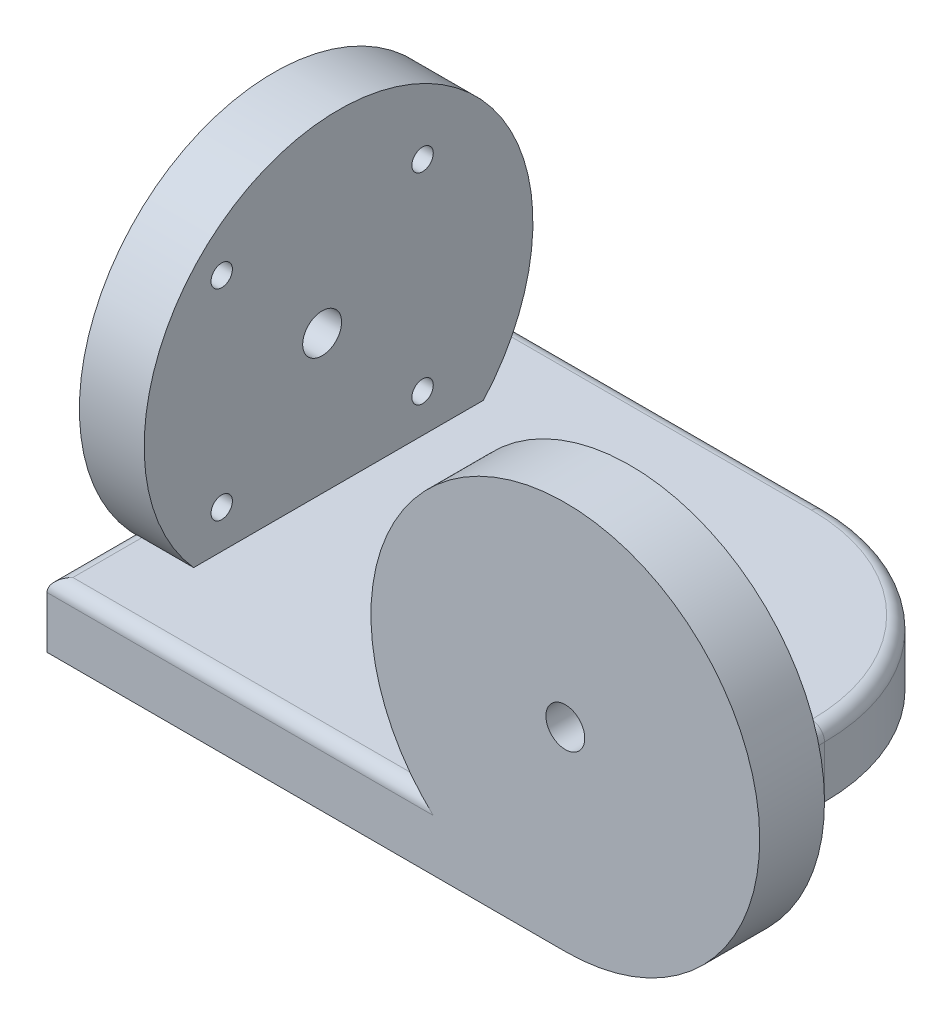
from build123d import *

# Parameters (mm, degrees)
SKETCH1_R                 = 30
BOSS_EXTRUDE1_DEPTH       = 10
SKETCH2_W                 = 80
SKETCH2_H                 = 10
BOSS_EXTRUDE2_DEPTH       = 70
SKETCH3_R                 = 30
BOSS_EXTRUDE3_DEPTH       = 10
F_6_0MM_DOWEL_HOLE2_D     = 6
M4X0_7_TAPPED_HOLE2_D     = 3.3
M4X0_7_TAPPED_HOLE2_DEPTH = 6
M4X0_7_TAPPED_HOLE2_TIP   = 0.991420021
F_6_0MM_DOWEL_HOLE4_D     = 6
M4X0_7_TAPPED_HOLE4_D     = 3.3
M4X0_7_TAPPED_HOLE4_DEPTH = 6
M4X0_7_TAPPED_HOLE4_TIP   = 0.991420021
FILLET1_R                 = 30
FILLET2_R                 = 2


with BuildPart() as part:
    # Sketch1 → Boss-Extrude1 (new body)
    with BuildSketch(Plane.XY):
        Circle(SKETCH1_R)
    extrude(amount=BOSS_EXTRUDE1_DEPTH)

    # Sketch2 → Boss-Extrude2 (add)
    with BuildSketch(Plane.XY.offset(10)):
        with Locations((-40, -25)):
            Rectangle(SKETCH2_W, SKETCH2_H)
    extrude(amount=-BOSS_EXTRUDE2_DEPTH)

    # Sketch3 → Boss-Extrude3 (add)
    with BuildSketch(Plane.ZY.offset(80)):
        with Locations((-25, 0)):
            Circle(SKETCH3_R)
    extrude(amount=-BOSS_EXTRUDE3_DEPTH)

    # Ø6.0mm Dowel Hole2 (through all)
    with Locations(Plane(origin=(0, 0, 0), x_dir=(-1, 0, 0), z_dir=(0, 0, -1))):
        with Locations((0, 0)):
            Hole(F_6_0MM_DOWEL_HOLE2_D / 2)

    # M4x0.7 Tapped Hole2
    with Locations(Plane(origin=(0, 0, 0), x_dir=(-1, 0, 0), z_dir=(0, 0, -1))):
        with Locations((-15.5, 15.5), (15.5, 15.5), (15.5, -15.5), (-15.5, -15.5)):
            Hole(M4X0_7_TAPPED_HOLE2_D / 2, depth=M4X0_7_TAPPED_HOLE2_DEPTH)
            with Locations((0, 0, -(M4X0_7_TAPPED_HOLE2_DEPTH + M4X0_7_TAPPED_HOLE2_TIP / 2))):  # 118° drill point
                Cone(0, M4X0_7_TAPPED_HOLE2_D / 2, M4X0_7_TAPPED_HOLE2_TIP, mode=Mode.SUBTRACT)

    # Ø6.0mm Dowel Hole4 (through all)
    with Locations(Plane(origin=(-70, 1.407077757, -22.469041667), x_dir=(0, 0, -1), z_dir=(1, 0, 0))):
        with Locations((0, 0)):
            Hole(F_6_0MM_DOWEL_HOLE4_D / 2)

    # M4x0.7 Tapped Hole4
    with Locations(Plane(origin=(-70, 1.407077757, -22.469041667), x_dir=(0, 0, -1), z_dir=(1, 0, 0))):
        with Locations((-15.5, 15.5), (15.5, 15.5), (15.5, -15.5), (-15.5, -15.5)):
            Hole(M4X0_7_TAPPED_HOLE4_D / 2, depth=M4X0_7_TAPPED_HOLE4_DEPTH)
            with Locations((0, 0, -(M4X0_7_TAPPED_HOLE4_DEPTH + M4X0_7_TAPPED_HOLE4_TIP / 2))):  # 118° drill point
                Cone(0, M4X0_7_TAPPED_HOLE4_D / 2, M4X0_7_TAPPED_HOLE4_TIP, mode=Mode.SUBTRACT)

    # Fillet1
    fillet1_edges = [part.edges().sort_by_distance(p)[0] for p in [
        (0, -25, -60),
    ]]
    fillet(fillet1_edges, radius=FILLET1_R)

    # Fillet2
    fillet2_edges = [part.edges().sort_by_distance(p)[0] for p in [
        (-80, -20, -53.680339887),
        (-51.180339887, -20, 10),
        (-80, -20, 3.680339887),
        (0, -20, -15),
        (-55, -20, -60),
        (-8.786796564, -20, -51.213203436),
    ]]
    fillet(fillet2_edges, radius=FILLET2_R)


solid = part.part
